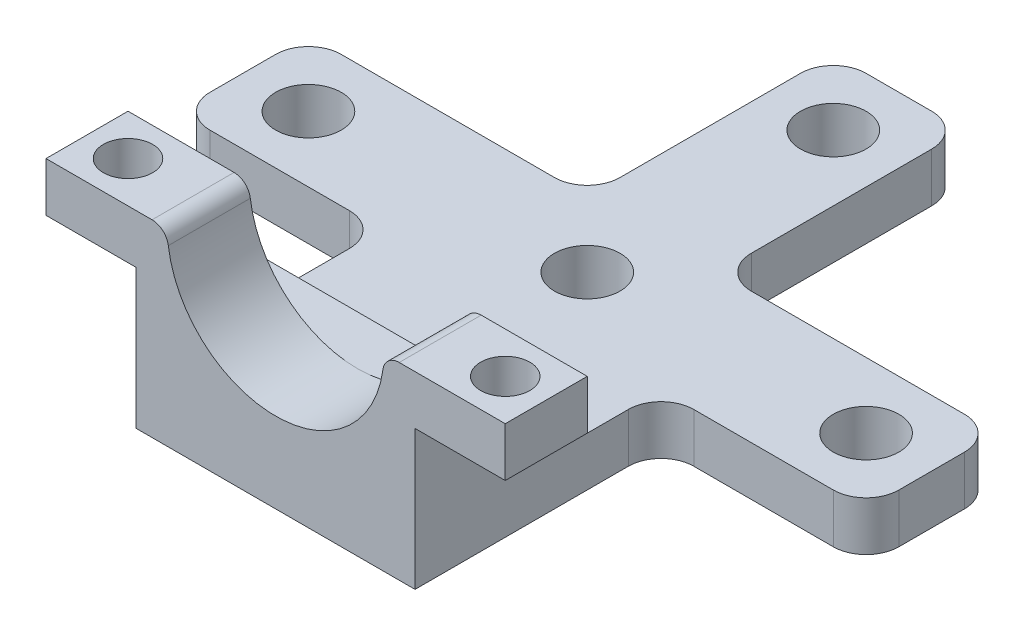
from build123d import *

# Parameters (mm, degrees)
SKETCH2_R           = 2
BOSS_EXTRUDE1_DEPTH = 3
SKETCH2_3_W         = 17
SKETCH2_3_H         = 15
BOSS_EXTRUDE2_DEPTH = 3
BOSS_EXTRUDE3_DEPTH = 5
SKETCH4_W           = 17
SKETCH4_H           = 1.9
BOSS_EXTRUDE4_DEPTH = 3
SKETCH5_R           = 1.5
CUT_EXTRUDE1_DEPTH  = 30.567718884
FILLET1_R           = 1
FILLET2_R           = 2


with BuildPart() as part:
    # Sketch2 → Boss-Extrude1 (new body)
    with BuildSketch(Plane(origin=(0, 0, 0), x_dir=(1, 0, 0), z_dir=(0, 1, 0))):
        Polygon((-4, 4), (-21, 4), (-21, -4), (21, -4), (21, 4), (4, 4), (4, 19), (-4, 19), align=None)
        with Locations((-17, 0)):
            Circle(SKETCH2_R, mode=Mode.SUBTRACT)
        Circle(SKETCH2_R, mode=Mode.SUBTRACT)
        with Locations((17, 0)):
            Circle(SKETCH2_R, mode=Mode.SUBTRACT)
        with Locations((0, 15)):
            Circle(SKETCH2_R, mode=Mode.SUBTRACT)
    extrude(amount=BOSS_EXTRUDE1_DEPTH)

    # Sketch2<3> → Boss-Extrude2 (add)
    with BuildSketch(Plane(origin=(0, 0, 0), x_dir=(1, 0, 0), z_dir=(0, 1, 0))):
        with Locations((0, -11.5)):
            Rectangle(SKETCH2_3_W, SKETCH2_3_H)
    extrude(amount=BOSS_EXTRUDE2_DEPTH)

    # Sketch3 → Boss-Extrude3 (add)
    with BuildSketch(Plane.XY.offset(19)):
        with BuildLine():
            Line((-8.5, 11.5), (-14, 11.5))
            Line((-14, 11.5), (-14, 8.5))
            Line((-14, 8.5), (-8.5, 8.5))
            Line((-8.5, 8.5), (-8.5, 3))
            Line((-8.5, 3), (8.5, 3))
            Line((8.5, 3), (8.5, 8.5))
            Line((8.5, 8.5), (14, 8.5))
            Line((14, 8.5), (14, 11.5))
            Line((14, 11.5), (8.5, 11.5))
            Line((8.5, 11.5), (6.6, 11.5))
            ThreePointArc((6.6, 11.5), (0, 4.9), (-6.6, 11.5))
            Line((-6.6, 11.5), (-8.5, 11.5))
        make_face()
    extrude(amount=-BOSS_EXTRUDE3_DEPTH)

    # Sketch4 → Boss-Extrude4 (add)
    with BuildSketch(Plane(origin=(0, 0, 14), x_dir=(-1, 0, 0), z_dir=(0, 0, -1))):
        with Locations((0, 3.95)):
            Rectangle(SKETCH4_W, SKETCH4_H)
    extrude(amount=BOSS_EXTRUDE4_DEPTH)

    # Sketch5 → Cut-Extrude1 (cut, through all)
    with BuildSketch(Plane.XZ.offset(-8.5)):
        with Locations((11.5, 16.5)):
            Circle(SKETCH5_R)
        with Locations((-11.5, 16.5)):
            Circle(SKETCH5_R)
    extrude(amount=-CUT_EXTRUDE1_DEPTH, mode=Mode.SUBTRACT)

    # Fillet1
    fillet1_edges = [part.edges().sort_by_distance(p)[0] for p in [
        (6.6, 11.5, 16.5),
        (-6.6, 11.5, 16.5),
    ]]
    fillet(fillet1_edges, radius=FILLET1_R)

    # Fillet2
    fillet2_edges = [part.edges().sort_by_distance(p)[0] for p in [
        (-21, 1.5, 4),
        (-21, 1.5, -4),
        (-4, 1.5, -19),
        (4, 1.5, -19),
        (21, 1.5, -4),
        (21, 1.5, 4),
        (4, 1.5, -4),
        (-4, 1.5, -4),
        (-8.5, 1.5, 4),
        (8.5, 1.5, 4),
    ]]
    fillet(fillet2_edges, radius=FILLET2_R)


solid = part.part
